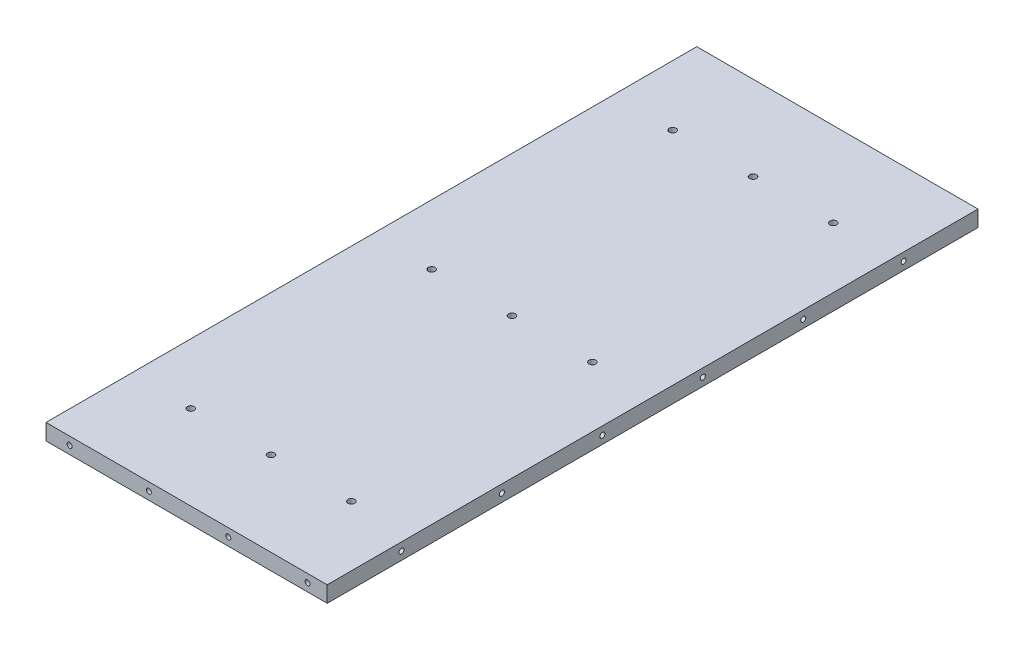
from build123d import *

# Parameters (mm, degrees)
SKETCH1_W                      = 140
SKETCH1_H                      = 324
BOSS_EXTRUDE1_DEPTH            = 8
M3X0_5_TAPPED_HOLE1_AT_2_COUNT = 2
M3X0_5_TAPPED_HOLE1_AT_2_PITCH = 39.5
M3X0_5_TAPPED_HOLE1_AT_3_COUNT = 2
M3X0_5_TAPPED_HOLE1_AT_3_PITCH = 79
M3X0_5_TAPPED_HOLE1_AT_4_COUNT = 2
M3X0_5_TAPPED_HOLE1_AT_4_PITCH = 118.5
M3X0_5_TAPPED_HOLE2_AT_2_COUNT = 2
M3X0_5_TAPPED_HOLE2_AT_2_PITCH = 50
M3X0_5_TAPPED_HOLE2_AT_3_COUNT = 2
M3X0_5_TAPPED_HOLE2_AT_3_PITCH = 100
M3X0_5_TAPPED_HOLE2_AT_4_COUNT = 2
M3X0_5_TAPPED_HOLE2_AT_4_PITCH = 150
M3X0_5_TAPPED_HOLE2_AT_5_COUNT = 2
M3X0_5_TAPPED_HOLE2_AT_5_PITCH = 200
M3X0_5_TAPPED_HOLE2_AT_6_COUNT = 2
M3X0_5_TAPPED_HOLE2_AT_6_PITCH = 250
F_3_4_3_4_DIAMETER_HOLE1_D     = 3.4
LPATTERN1_COUNT                = 2
LPATTERN1_PITCH                = 120
LPATTERN1_COUNT_DIR2           = 3
LPATTERN1_PITCH_DIR2           = 40
MIRROR3_COPY_1_D               = 3.4
MIRROR3_COPY_2_D               = 3.4
MIRROR3_COPY_3_D               = 3.4
MIRROR3_COPY_4_D               = 3.4
MIRROR3_COPY_5_D               = 3.4
MIRROR3_COPY_6_D               = 3.4


with BuildPart() as part:
    # Sketch1 → Boss-Extrude1 (new body)
    with BuildSketch(Plane(origin=(0, 0, 0), x_dir=(1, 0, 0), z_dir=(0, 1, 0))):
        Rectangle(SKETCH1_W, SKETCH1_H)
    extrude(amount=BOSS_EXTRUDE1_DEPTH)

    # Sketch5 → M3x0.5 Tapped Hole1 (revolve, cut)
    with BuildSketch(Plane(origin=(60.25, 4, 162), x_dir=(0, -1, 0), z_dir=(1, 0, 0))):
        Polygon((0, 0), (0, 12.251075774), (1.25, 11.5), (1.25, 0), align=None)
    m3x0_5_tapped_hole1 = revolve(axis=Axis((60.25, 4, 168.35), (0, 0, -1)), mode=Mode.SUBTRACT)

    # M3x0.5 Tapped Hole1 at 2: M3x0.5 Tapped Hole1 ×2
    with Locations(*[(-i * M3X0_5_TAPPED_HOLE1_AT_2_PITCH, 0, 0) for i in range(1, M3X0_5_TAPPED_HOLE1_AT_2_COUNT)]):
        add(m3x0_5_tapped_hole1, mode=Mode.SUBTRACT)

    # M3x0.5 Tapped Hole1 at 3: M3x0.5 Tapped Hole1 ×2
    with Locations(*[(-i * M3X0_5_TAPPED_HOLE1_AT_3_PITCH, 0, 0) for i in range(1, M3X0_5_TAPPED_HOLE1_AT_3_COUNT)]):
        add(m3x0_5_tapped_hole1, mode=Mode.SUBTRACT)

    # M3x0.5 Tapped Hole1 at 4: M3x0.5 Tapped Hole1 ×2
    with Locations(*[(-i * M3X0_5_TAPPED_HOLE1_AT_4_PITCH, 0, 0) for i in range(1, M3X0_5_TAPPED_HOLE1_AT_4_COUNT)]):
        add(m3x0_5_tapped_hole1, mode=Mode.SUBTRACT)

    # Sketch7 → M3x0.5 Tapped Hole2 (revolve, cut)
    with BuildSketch(Plane(origin=(-70, 4, -125), x_dir=(0, 0, 1), z_dir=(0, 1, 0))):
        Polygon((0, 0), (0, 12.251075774), (1.25, 11.5), (1.25, 0), align=None)
    m3x0_5_tapped_hole2 = revolve(axis=Axis((-76.35, 4, -125), (1, 0, 0)), mode=Mode.SUBTRACT)

    # M3x0.5 Tapped Hole2 at 2: M3x0.5 Tapped Hole2 ×2
    with Locations(*[(0, 0, i * M3X0_5_TAPPED_HOLE2_AT_2_PITCH) for i in range(1, M3X0_5_TAPPED_HOLE2_AT_2_COUNT)]):
        add(m3x0_5_tapped_hole2, mode=Mode.SUBTRACT)

    # M3x0.5 Tapped Hole2 at 3: M3x0.5 Tapped Hole2 ×2
    with Locations(*[(0, 0, i * M3X0_5_TAPPED_HOLE2_AT_3_PITCH) for i in range(1, M3X0_5_TAPPED_HOLE2_AT_3_COUNT)]):
        add(m3x0_5_tapped_hole2, mode=Mode.SUBTRACT)

    # M3x0.5 Tapped Hole2 at 4: M3x0.5 Tapped Hole2 ×2
    with Locations(*[(0, 0, i * M3X0_5_TAPPED_HOLE2_AT_4_PITCH) for i in range(1, M3X0_5_TAPPED_HOLE2_AT_4_COUNT)]):
        add(m3x0_5_tapped_hole2, mode=Mode.SUBTRACT)

    # M3x0.5 Tapped Hole2 at 5: M3x0.5 Tapped Hole2 ×2
    with Locations(*[(0, 0, i * M3X0_5_TAPPED_HOLE2_AT_5_PITCH) for i in range(1, M3X0_5_TAPPED_HOLE2_AT_5_COUNT)]):
        add(m3x0_5_tapped_hole2, mode=Mode.SUBTRACT)

    # M3x0.5 Tapped Hole2 at 6: M3x0.5 Tapped Hole2 ×2
    with Locations(*[(0, 0, i * M3X0_5_TAPPED_HOLE2_AT_6_PITCH) for i in range(1, M3X0_5_TAPPED_HOLE2_AT_6_COUNT)]):
        add(m3x0_5_tapped_hole2, mode=Mode.SUBTRACT)

    # Mirror1: M3x0.5 Tapped Hole1 across plane
    add(m3x0_5_tapped_hole1.mirror(Plane.XY), mode=Mode.SUBTRACT)

    # Mirror1 copy 1 sketch → Mirror1 copy 1 (revolve, cut)
    with BuildSketch(Plane(origin=(20.75, 4, -162), x_dir=(0, -1, 0), z_dir=(1, 0, 0))):
        Polygon((0, 0), (0, -12.251075774), (1.25, -11.5), (1.25, 0), align=None)
    revolve(axis=Axis((20.75, 4, -168.35), (0, 0, -1)), mode=Mode.SUBTRACT)

    # Mirror1 copy 2 sketch → Mirror1 copy 2 (revolve, cut)
    with BuildSketch(Plane(origin=(-18.75, 4, -162), x_dir=(0, -1, 0), z_dir=(1, 0, 0))):
        Polygon((0, 0), (0, -12.251075774), (1.25, -11.5), (1.25, 0), align=None)
    revolve(axis=Axis((-18.75, 4, -168.35), (0, 0, -1)), mode=Mode.SUBTRACT)

    # Mirror1 copy 3 sketch → Mirror1 copy 3 (revolve, cut)
    with BuildSketch(Plane(origin=(-58.25, 4, -162), x_dir=(0, -1, 0), z_dir=(1, 0, 0))):
        Polygon((0, 0), (0, -12.251075774), (1.25, -11.5), (1.25, 0), align=None)
    revolve(axis=Axis((-58.25, 4, -168.35), (0, 0, -1)), mode=Mode.SUBTRACT)

    # Mirror2: M3x0.5 Tapped Hole2 across plane
    add(m3x0_5_tapped_hole2.mirror(Plane(origin=(0, 0, 0), x_dir=(0, 0, 1), z_dir=(1, 0, 0))), mode=Mode.SUBTRACT)

    # Mirror2 copy 1 sketch → Mirror2 copy 1 (revolve, cut)
    with BuildSketch(Plane(origin=(70, 4, -75), x_dir=(0, 0, 1), z_dir=(0, 1, 0))):
        Polygon((0, 0), (0, -12.251075774), (1.25, -11.5), (1.25, 0), align=None)
    revolve(axis=Axis((76.35, 4, -75), (1, 0, 0)), mode=Mode.SUBTRACT)

    # Mirror2 copy 2 sketch → Mirror2 copy 2 (revolve, cut)
    with BuildSketch(Plane(origin=(70, 4, -25), x_dir=(0, 0, 1), z_dir=(0, 1, 0))):
        Polygon((0, 0), (0, -12.251075774), (1.25, -11.5), (1.25, 0), align=None)
    revolve(axis=Axis((76.35, 4, -25), (1, 0, 0)), mode=Mode.SUBTRACT)

    # Mirror2 copy 3 sketch → Mirror2 copy 3 (revolve, cut)
    with BuildSketch(Plane(origin=(70, 4, 25), x_dir=(0, 0, 1), z_dir=(0, 1, 0))):
        Polygon((0, 0), (0, -12.251075774), (1.25, -11.5), (1.25, 0), align=None)
    revolve(axis=Axis((76.35, 4, 25), (1, 0, 0)), mode=Mode.SUBTRACT)

    # Mirror2 copy 4 sketch → Mirror2 copy 4 (revolve, cut)
    with BuildSketch(Plane(origin=(70, 4, 75), x_dir=(0, 0, 1), z_dir=(0, 1, 0))):
        Polygon((0, 0), (0, -12.251075774), (1.25, -11.5), (1.25, 0), align=None)
    revolve(axis=Axis((76.35, 4, 75), (1, 0, 0)), mode=Mode.SUBTRACT)

    # Mirror2 copy 5 sketch → Mirror2 copy 5 (revolve, cut)
    with BuildSketch(Plane(origin=(70, 4, 125), x_dir=(0, 0, 1), z_dir=(0, 1, 0))):
        Polygon((0, 0), (0, -12.251075774), (1.25, -11.5), (1.25, 0), align=None)
    revolve(axis=Axis((76.35, 4, 125), (1, 0, 0)), mode=Mode.SUBTRACT)

    # Ø3.4 (3.4) Diameter Hole1 (through all)
    with Locations(Plane(origin=(-40, 8, 0), x_dir=(0, 0, 1), z_dir=(0, 1, 0))):
        with Locations((0, 0)):
            f_3_4_3_4_diameter_hole1 = Hole(F_3_4_3_4_DIAMETER_HOLE1_D / 2)

    # LPattern1: 3.4 _3.4_ Diameter Hole1 2 × 3
    with Locations(*[(j * LPATTERN1_PITCH_DIR2, 0, i * LPATTERN1_PITCH) for i in range(LPATTERN1_COUNT) for j in range(LPATTERN1_COUNT_DIR2) if (i, j) != (0, 0)]):
        add(f_3_4_3_4_diameter_hole1, mode=Mode.SUBTRACT)

    # Mirror3 copy 1 (through all)
    with Locations(Plane(origin=(0, 8, 0), x_dir=(0, 0, -1), z_dir=(0, 1, 0))):
        with Locations((0, 0)):
            Hole(MIRROR3_COPY_1_D / 2)

    # Mirror3 copy 2 (through all)
    with Locations(Plane(origin=(40, 8, 0), x_dir=(0, 0, -1), z_dir=(0, 1, 0))):
        with Locations((0, 0)):
            Hole(MIRROR3_COPY_2_D / 2)

    # Mirror3 copy 3 (through all)
    with Locations(Plane(origin=(-40, 8, -120), x_dir=(0, 0, -1), z_dir=(0, 1, 0))):
        with Locations((0, 0)):
            Hole(MIRROR3_COPY_3_D / 2)

    # Mirror3 copy 4 (through all)
    with Locations(Plane(origin=(0, 8, -120), x_dir=(0, 0, -1), z_dir=(0, 1, 0))):
        with Locations((0, 0)):
            Hole(MIRROR3_COPY_4_D / 2)

    # Mirror3 copy 5 (through all)
    with Locations(Plane(origin=(40, 8, -120), x_dir=(0, 0, -1), z_dir=(0, 1, 0))):
        with Locations((0, 0)):
            Hole(MIRROR3_COPY_5_D / 2)

    # Mirror3 copy 6 (through all)
    with Locations(Plane(origin=(-40, 8, 0), x_dir=(0, 0, -1), z_dir=(0, 1, 0))):
        with Locations((0, 0)):
            Hole(MIRROR3_COPY_6_D / 2)


solid = part.part
